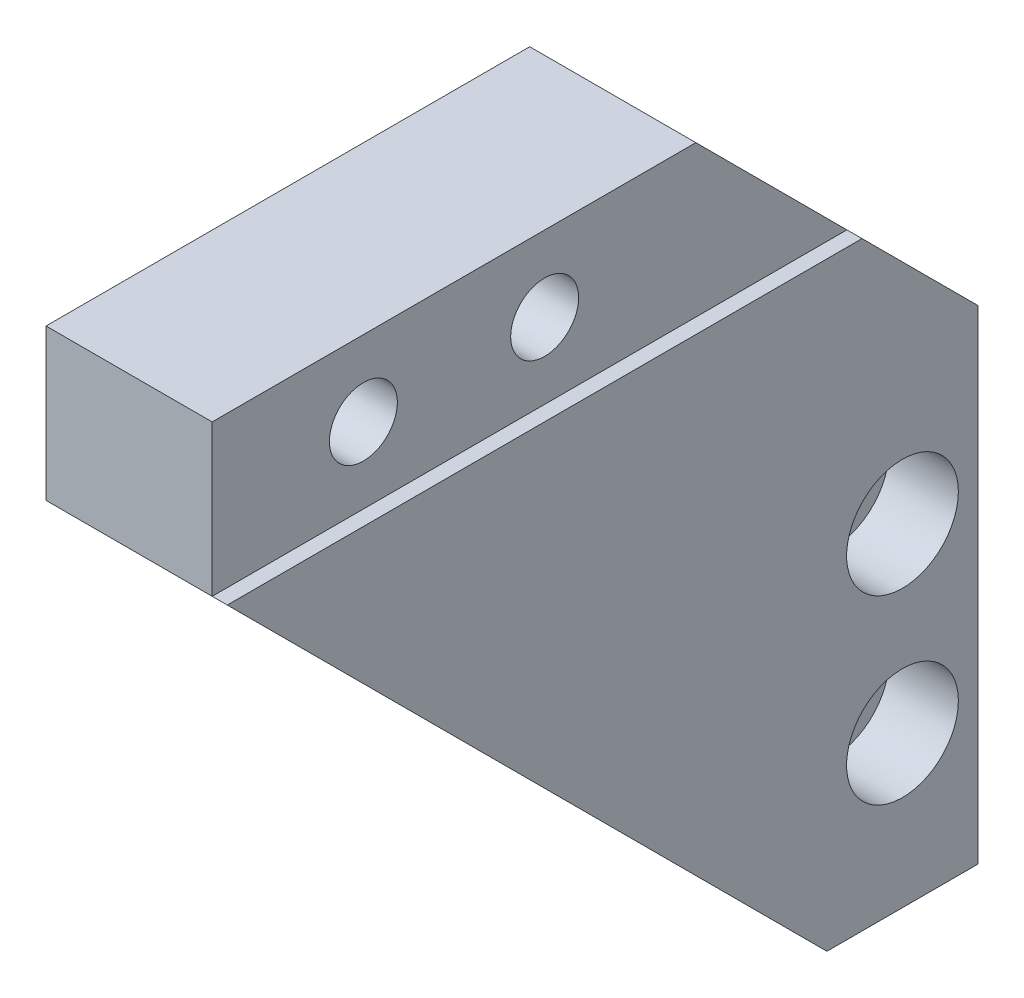
from build123d import *

# Parameters (mm, degrees)
EXTRUDE_1_DEPTH             = 6
HOLE_WIZARD_3_D             = 4.5
HOLE_WIZARD_3_CBORE_D       = 8
HOLE_WIZARD_3_CBORE_DEPTH   = 4.6
CUT_EXTRUDE_1_DEPTH         = 1
CUT_EXTRUDE_2_DEPTH         = 1
HOLE_WIZARD_2_D             = 4.5
HOLE_WIZARD_2_CBORE_D       = 7.4
HOLE_WIZARD_2_CBORE_DEPTH   = 4.6
HOLE_WIZARD_3_2_D           = 4.5
HOLE_WIZARD_3_2_CBORE_D     = 7.4
HOLE_WIZARD_3_2_CBORE_DEPTH = 4.6
CUT_EXTRUDE_3_DEPTH         = 86.277077811


with BuildPart() as part:
    # 草图1 → 凸台-拉伸1 (new, symmetric)
    with BuildSketch(Plane(origin=(0, 0, 0), x_dir=(0, 0, -1), z_dir=(1, 0, 0))):
        Polygon((0, 0), (42.02233047, 0), (59.7, -17.67766953), (59.7, -59.7), align=None)
    extrude(amount=EXTRUDE_1_DEPTH, both=True)

    # Hole Wizard 3 (through all)
    with Locations(Plane(origin=(0, 0, 0), x_dir=(1, 0, 0), z_dir=(0, -0.7071067811865477, 0.7071067811865475))):
        with Locations((0, -35.714274837), (0, -48.714274837)):
            CounterBoreHole(HOLE_WIZARD_3_D / 2, HOLE_WIZARD_3_CBORE_D / 2, HOLE_WIZARD_3_CBORE_DEPTH)

    # 草图10 → 切除-拉伸1 (cut)
    with BuildSketch(Plane.ZY.offset(-6)):
        Polygon((-42.02233047, 0), (0, 0), (-10, -10), (-52.02233047, -10), align=None)
    extrude(amount=CUT_EXTRUDE_1_DEPTH, mode=Mode.SUBTRACT)

    # 草图11 → 切除-拉伸2 (cut)
    with BuildSketch(Plane.ZY.offset(6)):
        Polygon((-59.7, -17.67766953), (-59.7, -59.7), (-49.7, -49.7), (-49.7, -7.67766953), align=None)
    extrude(amount=-CUT_EXTRUDE_2_DEPTH, mode=Mode.SUBTRACT)

    # 打孔尺寸根据内六角圆柱头螺钉的类型2 (through all)
    with Locations(Plane.ZY.offset(6)):
        with Locations((-20.011165235, -5), (-32.011165235, -5)):
            CounterBoreHole(HOLE_WIZARD_2_D / 2, HOLE_WIZARD_2_CBORE_D / 2, HOLE_WIZARD_2_CBORE_DEPTH)

    # Hole Wizard 3 2 (through all)
    with Locations(Plane(origin=(6, 0, 0), x_dir=(0, 0, -1), z_dir=(1, 0, 0))):
        with Locations((54.7, -39.688834765), (54.7, -27.688834765)):
            CounterBoreHole(HOLE_WIZARD_3_2_D / 2, HOLE_WIZARD_3_2_CBORE_D / 2, HOLE_WIZARD_3_2_CBORE_DEPTH)

    # 草图16 → 切除-拉伸3 (cut, through all)
    with BuildSketch(Plane(origin=(6, 0, 0), x_dir=(0, 0, -1), z_dir=(1, 0, 0))):
        Polygon((10, -10), (10, 0), (0, 0), align=None)
        Polygon((59.7, -59.7), (59.7, -49.7), (49.7, -49.7), align=None)
    extrude(amount=-CUT_EXTRUDE_3_DEPTH, mode=Mode.SUBTRACT)


solid = part.part
